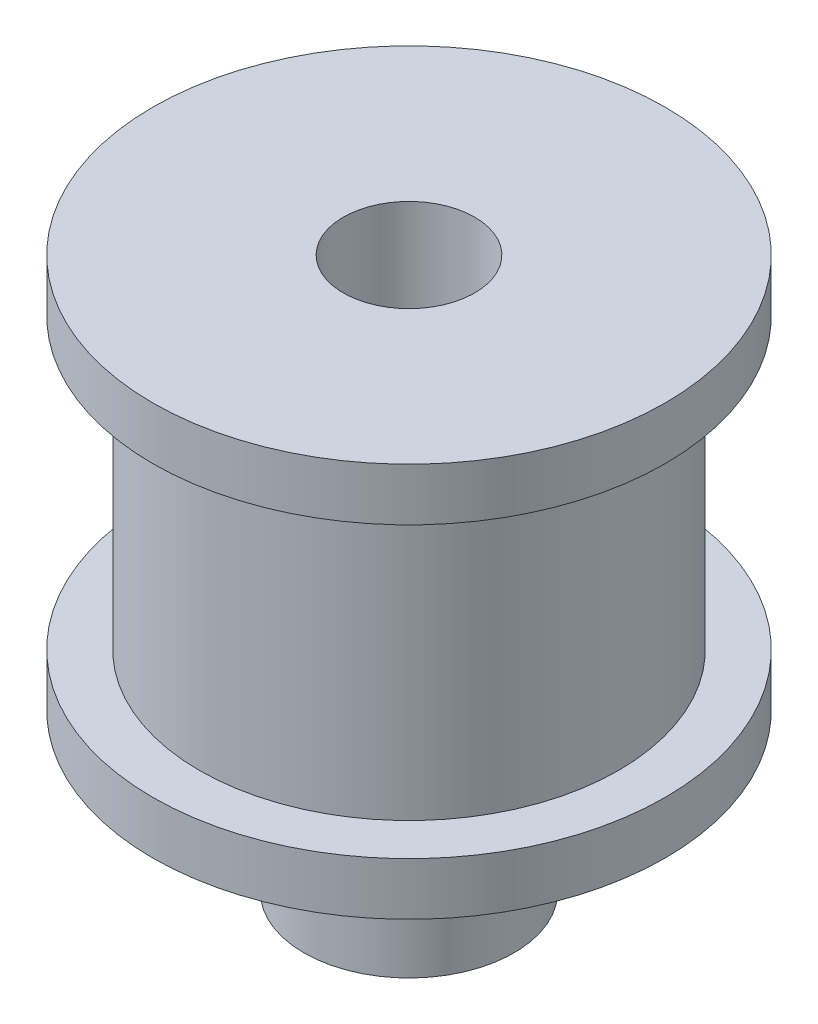
from build123d import *


with BuildPart() as part:
    # Esquisse1 → Révolution1 (revolve)
    with BuildSketch(Plane.XY, mode=Mode.PRIVATE) as r_volution1_sk:
        Polygon((2.5, 0), (2.5, 21), (9.75, 21), (9.75, 19), (7.975, 19), (7.975, 8), (9.75, 8), (9.75, 6), (4, 6), (4, 0), align=None)
    revolve(r_volution1_sk.sketch.rotate(Axis((0, 0, 0), (0, 1, 0)), 90), axis=Axis((0, 0, 0), (0, 1, 0)))


solid = part.part
